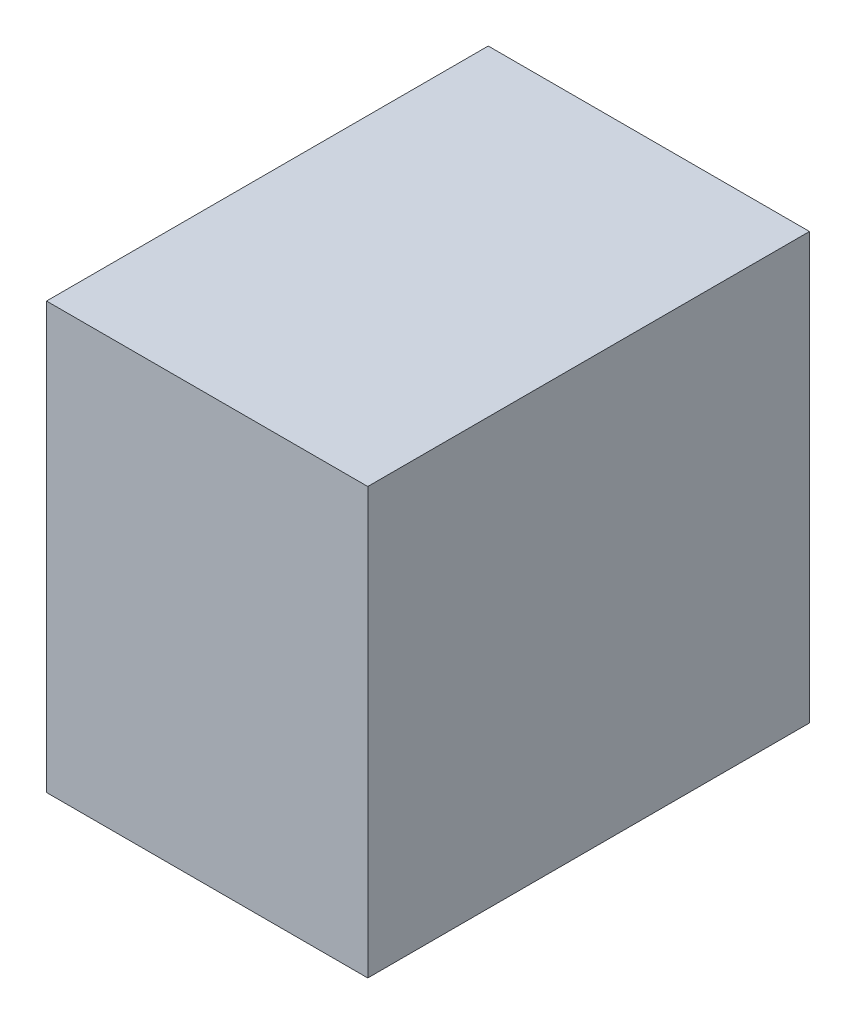
from build123d import *

# Parameters (mm, degrees)
SKETCH2_W           = 40
SKETCH2_H           = 55
BOSS_EXTRUDE1_DEPTH = 53


with BuildPart() as part:
    # Sketch2 → Boss-Extrude1 (new body)
    with BuildSketch(Plane(origin=(0, 0, 0), x_dir=(1, 0, 0), z_dir=(0, 1, 0))):
        Rectangle(SKETCH2_W, SKETCH2_H)
    extrude(amount=BOSS_EXTRUDE1_DEPTH)


solid = part.part
